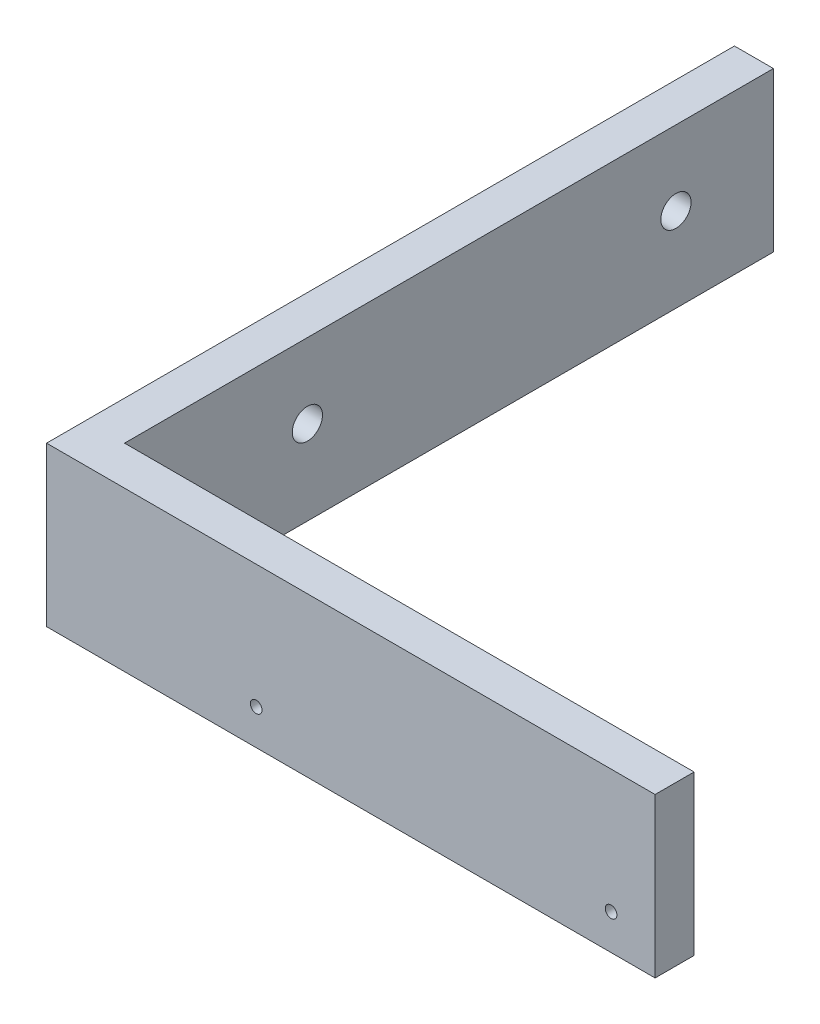
from build123d import *

# Parameters (mm, degrees)
SKETCH_1_W          = 62.4134
SKETCH_1_H          = 16.3
EXTRUDE_1_DEPTH     = 4
SKETCH_3_W          = 70.55
SKETCH_3_H          = 16.3
SKETCH_3_R          = 1.55
EXTRUDE_3_DEPTH     = 4
CUT_EXTRUDE_1_REACH = 77.702
SKETCH_4_R          = 0.6


with BuildPart() as part:
    # 草图1 → 凸台-拉伸1 (new body)
    with BuildSketch(Plane.XY):
        with Locations((-3.9433, 0)):
            Rectangle(SKETCH_1_W, SKETCH_1_H)
    extrude(amount=EXTRUDE_1_DEPTH)

    # 草图3 → 凸台-拉伸3 (add)
    with BuildSketch(Plane.ZY.offset(35.15)):
        with Locations((-31.275, 0)):
            Rectangle(SKETCH_3_W, SKETCH_3_H)
        with Locations((-56.55, 0.5)):
            Circle(SKETCH_3_R, mode=Mode.SUBTRACT)
        with Locations((-18.75, 0.5)):
            Circle(SKETCH_3_R, mode=Mode.SUBTRACT)
    extrude(amount=-EXTRUDE_3_DEPTH)

    # 草图4 → 切除-拉伸1 (cut, up to next)
    with BuildSketch(Plane(origin=(0, 0, 0), x_dir=(-1, 0, 0), z_dir=(0, 0, -1)), mode=Mode.PRIVATE) as cut_extrude_1_sk1:
        with Locations((-22.75, -4.52)):
            Circle(SKETCH_4_R)
    cut_extrude_1_tool1 = extrude(cut_extrude_1_sk1.sketch, amount=-CUT_EXTRUDE_1_REACH, mode=Mode.PRIVATE) & part.part
    # 草图4 → 切除-拉伸1 (cut, up to next)
    with BuildSketch(Plane(origin=(0, 0, 0), x_dir=(-1, 0, 0), z_dir=(0, 0, -1)), mode=Mode.PRIVATE) as cut_extrude_1_sk2:
        with Locations((13.65, -4.52)):
            Circle(SKETCH_4_R)
    cut_extrude_1_tool2 = extrude(cut_extrude_1_sk2.sketch, amount=-CUT_EXTRUDE_1_REACH, mode=Mode.PRIVATE) & part.part
    add(cut_extrude_1_tool1.solids().sort_by_distance((22.75, -4.52, 0))[0], mode=Mode.SUBTRACT)
    add(cut_extrude_1_tool2.solids().sort_by_distance((-13.65, -4.52, 0))[0], mode=Mode.SUBTRACT)


solid = part.part
